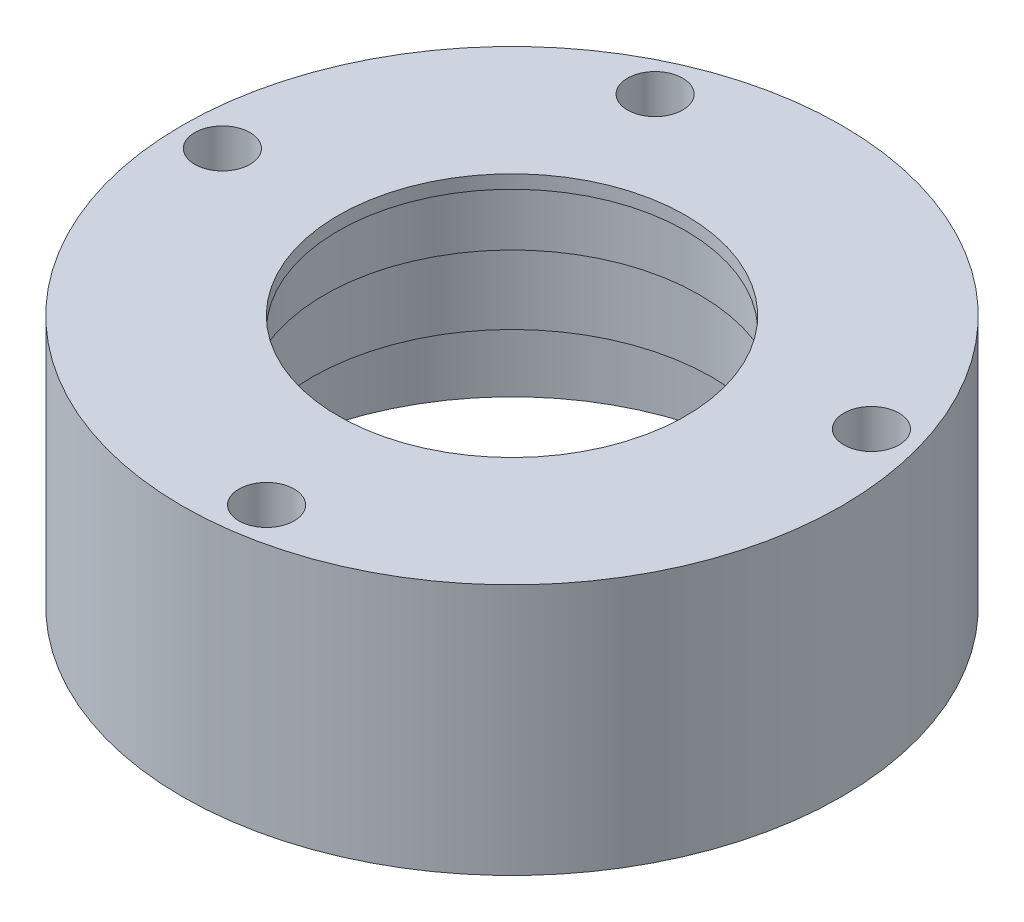
from build123d import *

# Parameters (mm, degrees)
SKETCH1_R           = 37
BOSS_EXTRUDE1_DEPTH = 28.25
SKETCH2_R           = 28.8
CUT_EXTRUDE1_DEPTH  = 11
SKETCH3_R           = 22.5
CUT_EXTRUDE2_DEPTH  = 8.75
SKETCH4_R           = 21.05
CUT_EXTRUDE3_DEPTH  = 7
SKETCH5_R           = 19.5
CUT_EXTRUDE4_DEPTH  = 59.767018812
SKETCH6_R           = 1.675
CUT_EXTRUDE5_DEPTH  = 15.75
CIRPATTERN1_COUNT   = 11
SKETCH7_R           = 1.7
CUT_EXTRUDE6_DEPTH  = 60.464800513
SKETCH8_R           = 3.1
CUT_EXTRUDE7_DEPTH  = 16.75


with BuildPart() as part:
    # Sketch1 → Boss-Extrude1 (new body)
    with BuildSketch(Plane(origin=(0, 0, 0), x_dir=(1, 0, 0), z_dir=(0, 1, 0))):
        with Locations(Location((0, 0, 0), (0, 0, 270))):
            Circle(SKETCH1_R)
    extrude(amount=BOSS_EXTRUDE1_DEPTH)

    # Sketch2 → Cut-Extrude1 (cut)
    with BuildSketch(Plane(origin=(0, 0, 0), x_dir=(1, 0, 0), z_dir=(0, 1, 0))):
        with Locations(Location((0, 0, 0), (0, 0, 270))):
            Circle(SKETCH2_R)
    extrude(amount=CUT_EXTRUDE1_DEPTH, mode=Mode.SUBTRACT)

    # Sketch3 → Cut-Extrude2 (cut)
    with BuildSketch(Plane.XZ.offset(-11)):
        with Locations(Location((0, 0, 0), (0, 0, 270))):
            Circle(SKETCH3_R)
    extrude(amount=-CUT_EXTRUDE2_DEPTH, mode=Mode.SUBTRACT)

    # Sketch4 → Cut-Extrude3 (cut)
    with BuildSketch(Plane.XZ.offset(-19.75)):
        with Locations(Location((0, 0, 0), (0, 0, 270))):
            Circle(SKETCH4_R)
    extrude(amount=-CUT_EXTRUDE3_DEPTH, mode=Mode.SUBTRACT)

    # Sketch5 → Cut-Extrude4 (cut, through all)
    with BuildSketch(Plane.XZ.offset(-26.75)):
        with Locations(Location((0, 0, 0), (0, 0, 270))):
            Circle(SKETCH5_R)
    extrude(amount=-CUT_EXTRUDE4_DEPTH, mode=Mode.SUBTRACT)

    # Sketch6 → Cut-Extrude5 (cut)
    with BuildSketch(Plane(origin=(0, 0, 0), x_dir=(1, 0, 0), z_dir=(0, 1, 0))):
        with Locations(Location((27, 0, 0), (0, 0, 270))):
            Circle(SKETCH6_R)
    cut_extrude5 = extrude(amount=CUT_EXTRUDE5_DEPTH, mode=Mode.SUBTRACT)

    # CirPattern1: Cut-Extrude5 ×11 about axis
    cirpattern1_axis = Axis((0, 0, 0), (0, 1, 0))
    for i in range(1, CIRPATTERN1_COUNT):
        add(cut_extrude5.rotate(cirpattern1_axis, i * 360 / CIRPATTERN1_COUNT), mode=Mode.SUBTRACT)

    # Sketch7 → Cut-Extrude6 (cut, through all)
    with BuildSketch(Plane(origin=(0, 0, 0), x_dir=(1, 0, 0), z_dir=(0, 1, 0))):
        with Locations(Location((31.184102699, 9.154328969, 0), (0, 0, 270))):
            Circle(SKETCH7_R)
        with Locations(Location((-13.503333209, 29.56196868, 0), (0, 0, 270))):
            Circle(SKETCH7_R)
        with Locations(Location((-32.5, 0, 0), (0, 0, 270))):
            Circle(SKETCH7_R)
        with Locations(Location((4.624211408, -32.169343619, 0), (0, 0, 270))):
            Circle(SKETCH7_R)
    extrude(amount=CUT_EXTRUDE6_DEPTH, mode=Mode.SUBTRACT)

    # Sketch8 → Cut-Extrude7 (cut)
    with BuildSketch(Plane(origin=(0, 28.25, 0), x_dir=(1, 0, 0), z_dir=(0, 1, 0))):
        with Locations(Location((31.184102699, 9.154328969, 0), (0, 0, 270))):
            Circle(SKETCH8_R)
        with Locations(Location((-13.503333209, 29.56196868, 0), (0, 0, 270))):
            Circle(SKETCH8_R)
        with Locations(Location((-32.5, 0, 0), (0, 0, 270))):
            Circle(SKETCH8_R)
        with Locations(Location((4.624211408, -32.169343619, 0), (0, 0, 270))):
            Circle(SKETCH8_R)
    extrude(amount=-CUT_EXTRUDE7_DEPTH, mode=Mode.SUBTRACT)


solid = part.part
